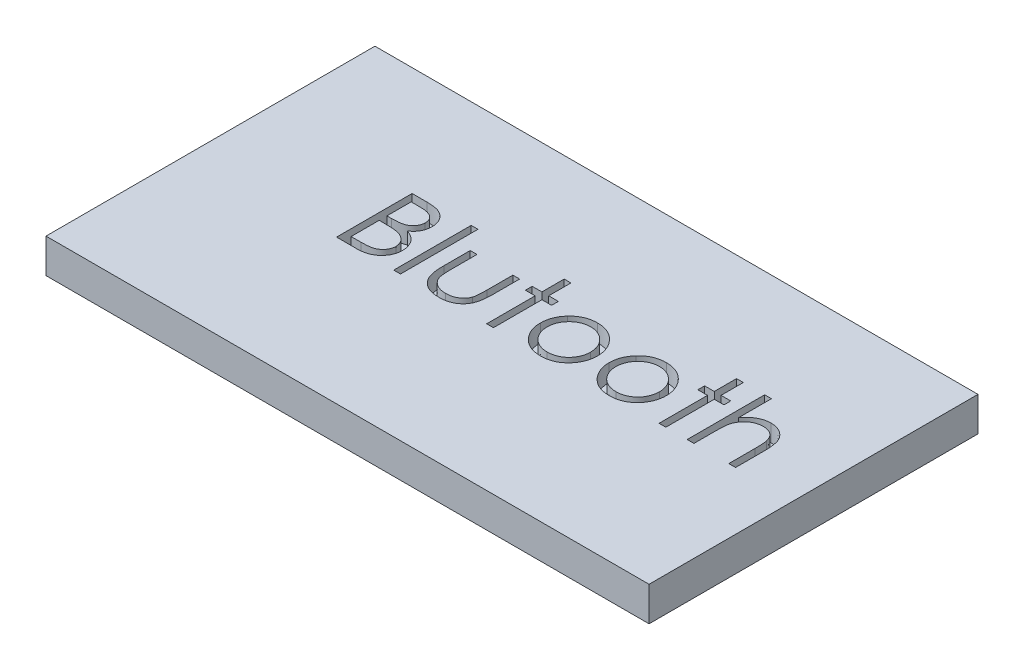
from build123d import *

# Parameters (mm, degrees)
SKETCH1_W           = 27.94
SKETCH1_H           = 15.24
BOSS_EXTRUDE1_DEPTH = 1.5875
SKETCH2_W           = 0.314102564
SKETCH2_H           = 3.58974359
CUT_EXTRUDE1_DEPTH  = 0.79375


with BuildPart() as part:
    # Sketch1 → Boss-Extrude1 (new body)
    with BuildSketch(Plane(origin=(0, 0, 0), x_dir=(1, 0, 0), z_dir=(0, 1, 0))):
        Rectangle(SKETCH1_W, SKETCH1_H)
    extrude(amount=BOSS_EXTRUDE1_DEPTH)

    # Sketch2 → Cut-Extrude1 (cut)
    # profile 1 of 8: a face of its own
    with BuildSketch(Plane(origin=(0, 1.5875, 0), x_dir=(1, 0, 0), z_dir=(0, 1, 0))):
        with BuildLine():
            Line((-7.198179967, 2.570414857), (-6.515287339, 2.570414857))
            add(Edge.make_bspline(
                [(-6.515287339, 2.570414857), (-6.481858861, 2.570239107), (-6.417066151, 2.569898459), (-6.322846709, 2.564615328), (-6.234597898, 2.557411658), (-6.152294126, 2.545981565), (-6.075973423, 2.532189788), (-6.005405786, 2.515487972), (-5.940815614, 2.495461358), (-5.863702877, 2.463615077), (-5.775782217, 2.416291909), (-5.680583824, 2.346363344), (-5.599179585, 2.26083088), (-5.528993267, 2.164348225), (-5.473192148, 2.058212453), (-5.43282285, 1.944953264), (-5.407264975, 1.826031523), (-5.404636541, 1.744388345), (-5.403308172, 1.703127197)],
                knots=[0, 0, 0, 0, 1.001505555, 1.941167018, 2.826882275, 3.653841531, 4.429895133, 5.150066043, 5.825578002, 6.45369114, 7.647487171, 8.808567382, 9.977351308, 11.170798116, 12.373658725, 13.556498008, 14.765093433, 16, 16, 16, 16], degree=3))
            add(Edge.make_bspline(
                [(-5.403308172, 1.703127197), (-5.404401391, 1.664474641), (-5.406549668, 1.588518724), (-5.427092428, 1.477424615), (-5.459253096, 1.371673396), (-5.503958345, 1.271651011), (-5.562060341, 1.179617398), (-5.63091866, 1.094830132), (-5.713995463, 1.020879075), (-5.776238703, 0.979536172), (-5.807855448, 0.958535851)],
                knots=[0, 0, 0, 0, 1.044552857, 2.05264487, 3.044412934, 4.028983338, 5.005914585, 5.980388656, 6.974128949, 8, 8, 8, 8], degree=3))
            add(Edge.make_bspline(
                [(-5.807855448, 0.958535851), (-5.768095021, 0.943270852), (-5.692023473, 0.914065128), (-5.587337461, 0.862429664), (-5.497142616, 0.806267553), (-5.42074547, 0.744935703), (-5.355407815, 0.678826892), (-5.298354873, 0.606971778), (-5.249673499, 0.52843302), (-5.207960576, 0.444029485), (-5.175411819, 0.354623016), (-5.151035915, 0.26105224), (-5.137068466, 0.163652685), (-5.135080825, 0.097367306), (-5.134077403, 0.063904441)],
                knots=[0, 0, 0, 0, 1.27268992, 2.434971085, 3.483601985, 4.442670788, 5.356604649, 6.2567628, 7.179492994, 8.113709626, 9.066344395, 10.018646069, 10.999752585, 12, 12, 12, 12], degree=3))
            add(Edge.make_bspline(
                [(-5.134077403, 0.063904441), (-5.135054249, 0.029737568), (-5.136976221, -0.03748671), (-5.151156193, -0.136241844), (-5.1751653, -0.230616791), (-5.208236446, -0.321221974), (-5.251398761, -0.407882108), (-5.303926725, -0.490695372), (-5.366558289, -0.568829703), (-5.436621158, -0.643153326), (-5.515883303, -0.709981113), (-5.601399058, -0.76949682), (-5.694245378, -0.818442882), (-5.792897372, -0.859558903), (-5.898461688, -0.890966102), (-6.010464296, -0.912938676), (-6.128808597, -0.927743713), (-6.210018349, -0.928960918), (-6.251665544, -0.929585143)],
                knots=[0, 0, 0, 0, 0.978564426, 1.925352924, 2.850884081, 3.763762016, 4.682927383, 5.618979971, 6.567305752, 7.547517671, 8.540179244, 9.531824382, 10.526200242, 11.540722885, 12.589160233, 13.674978461, 14.80764778, 16, 16, 16, 16], degree=3))
            Line((-6.251665544, -0.929585143), (-7.198179967, -0.929585143))
            Line((-7.198179967, -0.929585143), (-7.198179967, 2.570414857))
        make_face()
        with BuildLine():
            Line((-6.884077403, 2.211440498), (-6.884077403, 1.089645626))
            Line((-6.884077403, 1.089645626), (-6.673039743, 1.089645626))
            add(Edge.make_bspline(
                [(-6.673039743, 1.089645626), (-6.642190948, 1.090045549), (-6.582584788, 1.090818282), (-6.496264892, 1.093031799), (-6.416139874, 1.099229843), (-6.342348041, 1.105426105), (-6.275005597, 1.115500692), (-6.214261735, 1.127492815), (-6.159163138, 1.14017572), (-6.095623593, 1.161745207), (-6.023550644, 1.193622883), (-5.94671754, 1.243094719), (-5.87898307, 1.302019072), (-5.821785883, 1.370010034), (-5.774974412, 1.444876219), (-5.742460697, 1.5254231), (-5.720413413, 1.609643232), (-5.718421881, 1.667461485), (-5.717410737, 1.696817101)],
                knots=[0, 0, 0, 0, 1.156816544, 2.235205308, 3.236616184, 4.169592532, 5.011045266, 5.787822928, 6.49130361, 7.128639758, 8.301311294, 9.436451833, 10.541879658, 11.654887649, 12.756523258, 13.837046038, 14.901820046, 16, 16, 16, 16], degree=3))
            add(Edge.make_bspline(
                [(-5.717410737, 1.696817101), (-5.717936917, 1.716242872), (-5.718969077, 1.754348644), (-5.727422379, 1.809897999), (-5.741789954, 1.862141751), (-5.760244247, 1.911795861), (-5.786032936, 1.957307712), (-5.816396399, 2.000250907), (-5.853082089, 2.039163026), (-5.894839402, 2.075532524), (-5.942848025, 2.107777052), (-5.997079317, 2.136017815), (-6.058266994, 2.158758592), (-6.125379849, 2.178674744), (-6.199450936, 2.192663038), (-6.27962549, 2.204316426), (-6.366560209, 2.210249168), (-6.426705311, 2.211034531), (-6.457795352, 2.211440498)],
                knots=[0, 0, 0, 0, 0.91205012, 1.789085906, 2.630437955, 3.453916878, 4.269457761, 5.079663411, 5.91843418, 6.774407191, 7.675494373, 8.627863946, 9.638891023, 10.736472738, 11.911756761, 13.175263542, 14.539845004, 16, 16, 16, 16], degree=3))
            Line((-6.457795352, 2.211440498), (-6.884077403, 2.211440498))
        make_face(mode=Mode.SUBTRACT)
        with BuildLine():
            Line((-6.884077403, 0.730671268), (-6.884077403, -0.570610784))
            Line((-6.884077403, -0.570610784), (-6.436761698, -0.570610784))
            add(Edge.make_bspline(
                [(-6.436761698, -0.570610784), (-6.404742772, -0.570227036), (-6.343030514, -0.569487414), (-6.253929284, -0.567072859), (-6.17134618, -0.561580584), (-6.095658044, -0.552934734), (-6.026047591, -0.543556285), (-5.963349888, -0.530945004), (-5.907056695, -0.516496043), (-5.841782387, -0.494161871), (-5.768278879, -0.4594654), (-5.689068022, -0.407151174), (-5.618641804, -0.344827866), (-5.558836545, -0.272696952), (-5.509823557, -0.194265625), (-5.474168101, -0.111120275), (-5.452177245, -0.024634747), (-5.449515075, 0.034331965), (-5.448179967, 0.063904441)],
                knots=[0, 0, 0, 0, 1.160039823, 2.235823828, 3.228722157, 4.157150951, 4.99529583, 5.772374946, 6.472645482, 7.099169577, 8.269452708, 9.405989375, 10.527446681, 11.663510218, 12.788923519, 13.866172445, 14.929861265, 16, 16, 16, 16], degree=3))
            add(Edge.make_bspline(
                [(-5.448179967, 0.063904441), (-5.448456072, 0.082397781), (-5.449003827, 0.119086163), (-5.457264442, 0.173001982), (-5.469278311, 0.225227855), (-5.484809745, 0.275905596), (-5.507429212, 0.324118972), (-5.533835757, 0.370821532), (-5.564797159, 0.416075011), (-5.613041325, 0.473287265), (-5.68321331, 0.539204278), (-5.782920085, 0.60374178), (-5.896292383, 0.655789587), (-5.978519876, 0.677889063), (-6.020996474, 0.689305082)],
                knots=[0, 0, 0, 0, 0.723448775, 1.435228256, 2.130040452, 2.821711965, 3.505591119, 4.210454504, 4.921174351, 5.648778258, 7.137944449, 8.670945889, 10.280296675, 12, 12, 12, 12], degree=3))
            add(Edge.make_bspline(
                [(-6.020996474, 0.689305082), (-6.03802557, 0.692760166), (-6.074948162, 0.7002515), (-6.135155742, 0.708159204), (-6.203891611, 0.715204264), (-6.281314489, 0.720415421), (-6.36752233, 0.725801965), (-6.462699248, 0.727896786), (-6.566456563, 0.730396046), (-6.638448935, 0.73057718), (-6.67584423, 0.730671268)],
                knots=[0, 0, 0, 0, 0.634451884, 1.375622551, 2.216452059, 3.157844607, 4.20941857, 5.370758133, 6.634282058, 8, 8, 8, 8], degree=3))
            Line((-6.67584423, 0.730671268), (-6.884077403, 0.730671268))
        make_face(mode=Mode.SUBTRACT)
    # profile 2 of 8: a face of its own
    with BuildSketch(Plane(origin=(0, 1.5875, 0), x_dir=(1, 0, 0), z_dir=(0, 1, 0))):
        with Locations((-4.393692788, 0.865286652)):
            Rectangle(SKETCH2_W, SKETCH2_H)
    # profile 3 of 8: a face of its own
    with BuildSketch(Plane(origin=(0, 1.5875, 0), x_dir=(1, 0, 0), z_dir=(0, 1, 0))):
        with BuildLine():
            Line((-3.563564583, 1.628107165), (-3.249462019, 1.628107165))
            Line((-3.249462019, 1.628107165), (-3.249462019, 0.441809088))
            add(Edge.make_bspline(
                [(-3.249462019, 0.441809088), (-3.249320114, 0.406986339), (-3.249048656, 0.340372051), (-3.247207715, 0.244516864), (-3.242877622, 0.157100151), (-3.237463797, 0.078071415), (-3.230501661, 0.007444023), (-3.222218301, -0.054535334), (-3.212959879, -0.108569518), (-3.203897165, -0.141112874), (-3.199682371, -0.156247803)],
                knots=[0, 0, 0, 0, 1.388932606, 2.656963016, 3.823490214, 4.879454478, 5.816252168, 6.653371382, 7.373723809, 8, 8, 8, 8], degree=3))
            add(Edge.make_bspline(
                [(-3.199682371, -0.156247803), (-3.192920916, -0.175270674), (-3.179538575, -0.212920935), (-3.155265091, -0.26730994), (-3.125236755, -0.317685223), (-3.092376927, -0.365989295), (-3.054477519, -0.410791282), (-3.012018048, -0.452015526), (-2.966419811, -0.491219617), (-2.898664788, -0.537604409), (-2.806005522, -0.587319739), (-2.684352767, -0.630215558), (-2.552448541, -0.655851378), (-2.461283821, -0.658825633), (-2.414425961, -0.660354374)],
                knots=[0, 0, 0, 0, 0.725840625, 1.436591201, 2.137033971, 2.831655856, 3.53531722, 4.242432219, 4.957935707, 5.694543706, 7.190802206, 8.724350549, 10.316345118, 12, 12, 12, 12], degree=3))
            add(Edge.make_bspline(
                [(-2.414425961, -0.660354374), (-2.367572453, -0.658793125), (-2.276919585, -0.655772398), (-2.146464616, -0.630988859), (-2.027213201, -0.58958317), (-1.92036225, -0.531775758), (-1.82639641, -0.461033696), (-1.748091991, -0.378024887), (-1.683484736, -0.2853755), (-1.655275316, -0.216251221), (-1.641088621, -0.181488188)],
                knots=[0, 0, 0, 0, 1.157059328, 2.238695713, 3.266970494, 4.264342957, 5.228770407, 6.160125903, 7.074715775, 8, 8, 8, 8], degree=3))
            add(Edge.make_bspline(
                [(-1.641088621, -0.181488188), (-1.636894391, -0.167521889), (-1.627621973, -0.136645814), (-1.617659621, -0.084266065), (-1.60868516, -0.021801461), (-1.601021984, 0.051156748), (-1.595556821, 0.134417901), (-1.592610794, 0.227955977), (-1.589282519, 0.331477337), (-1.589232003, 0.403945096), (-1.589205608, 0.441809088)],
                knots=[0, 0, 0, 0, 0.557542046, 1.232589297, 2.036731608, 2.971723315, 4.038036528, 5.22795436, 6.551621927, 8, 8, 8, 8], degree=3))
            Line((-1.589205608, 0.441809088), (-1.589205608, 1.628107165))
            Line((-1.589205608, 1.628107165), (-1.275103044, 1.628107165))
            Line((-1.275103044, 1.628107165), (-1.275103044, 0.382914857))
            add(Edge.make_bspline(
                [(-1.275103044, 0.382914857), (-1.275544739, 0.340607686), (-1.276401687, 0.258525986), (-1.281909031, 0.139241874), (-1.291358644, 0.02807963), (-1.305701329, -0.07501959), (-1.322567003, -0.169977072), (-1.344323276, -0.256914518), (-1.370301514, -0.335564072), (-1.399607029, -0.407305849), (-1.434228896, -0.472352743), (-1.471055917, -0.53408856), (-1.513580689, -0.590981495), (-1.558350923, -0.645863632), (-1.608152579, -0.696005159), (-1.662052438, -0.742556635), (-1.719291858, -0.786229667), (-1.781141056, -0.825320946), (-1.846697119, -0.860537592), (-1.916040976, -0.89175367), (-1.990021974, -0.916456247), (-2.067685611, -0.937766913), (-2.14941239, -0.954481382), (-2.235123523, -0.966267949), (-2.324790139, -0.97349328), (-2.385899599, -0.974130324), (-2.417230448, -0.974456938)],
                knots=[0, 0, 0, 0, 1.493040784, 2.896703357, 4.213163133, 5.428574705, 6.569057535, 7.615249723, 8.588095153, 9.490268104, 10.346124644, 11.18633936, 12.024365274, 12.850166724, 13.684164916, 14.514361689, 15.362232829, 16.222528818, 17.093394965, 17.986930858, 18.902426812, 19.842810585, 20.827885679, 21.843828298, 22.894529745, 24, 24, 24, 24], degree=3))
            add(Edge.make_bspline(
                [(-2.417230448, -0.974456938), (-2.448326962, -0.97411723), (-2.509434507, -0.973449674), (-2.599105752, -0.966307867), (-2.685054358, -0.954499696), (-2.766974756, -0.937644479), (-2.844949154, -0.916605409), (-2.919293394, -0.891601873), (-2.989136957, -0.860521391), (-3.055318961, -0.825543834), (-3.117321349, -0.785978559), (-3.175429927, -0.742610519), (-3.229566779, -0.695504456), (-3.279743847, -0.644857099), (-3.325256824, -0.590040162), (-3.366672866, -0.531494602), (-3.404629571, -0.469800513), (-3.438982361, -0.403737351), (-3.468494117, -0.331165341), (-3.494549363, -0.250868244), (-3.515860001, -0.161965727), (-3.533202469, -0.064533799), (-3.54715391, 0.040961243), (-3.556840052, 0.155129658), (-3.562255883, 0.27769335), (-3.563118944, 0.36234324), (-3.563564583, 0.406051876)],
                knots=[0, 0, 0, 0, 1.083640291, 2.129454052, 3.13281866, 4.105697902, 5.042300162, 5.946461698, 6.836384745, 7.703652036, 8.553297018, 9.397182691, 10.228592656, 11.052265423, 11.879314572, 12.708807002, 13.549817954, 14.402308542, 15.300838682, 16.27712199, 17.341985831, 18.484375296, 19.725102775, 21.0496083, 22.476576903, 24, 24, 24, 24], degree=3))
            Line((-3.563564583, 0.406051876), (-3.563564583, 1.628107165))
        make_face()
    # profile 4 of 8: a face of its own
    with BuildSketch(Plane(origin=(0, 1.5875, 0), x_dir=(1, 0, 0), z_dir=(0, 1, 0))):
        Polygon((-0.243051762, 2.660158447), (0.071050802, 2.660158447), (0.071050802, 1.628107165), (0.519768751, 1.628107165), (0.519768751, 1.314004601), (0.071050802, 1.314004601), (0.071050802, -0.929585143), (-0.243051762, -0.929585143), (-0.243051762, 1.314004601), (-0.691769711, 1.314004601), (-0.691769711, 1.628107165), (-0.243051762, 1.628107165), align=None)
    # profile 5 of 8: a face of its own
    with BuildSketch(Plane(origin=(0, 1.5875, 0), x_dir=(1, 0, 0), z_dir=(0, 1, 0))):
        with BuildLine():
            add(Edge.make_bspline(
                [(2.293606892, 1.67297896), (2.341598164, 1.671957069), (2.435697322, 1.66995339), (2.573505208, 1.648538424), (2.705050344, 1.61579106), (2.830836536, 1.570519498), (2.949252831, 1.509837547), (3.062024076, 1.437428256), (3.168841084, 1.351645663), (3.232864114, 1.285287594), (3.265361699, 1.251604761)],
                knots=[0, 0, 0, 0, 1.054011418, 2.066658804, 3.057071809, 4.030435133, 4.997543892, 5.974964718, 6.972108034, 8, 8, 8, 8], degree=3))
            add(Edge.make_bspline(
                [(3.265361699, 1.251604761), (3.293343653, 1.219390775), (3.348766034, 1.155586233), (3.419831752, 1.05213062), (3.481053313, 0.94499052), (3.530116274, 0.832743193), (3.568801297, 0.716368522), (3.596266993, 0.595466511), (3.612603928, 0.470304163), (3.614806895, 0.385300325), (3.615922597, 0.342249793)],
                knots=[0, 0, 0, 0, 1.025258237, 2.030674902, 3.01204498, 3.988269485, 4.97094183, 5.956517959, 6.965070386, 8, 8, 8, 8], degree=3))
            add(Edge.make_bspline(
                [(3.615922597, 0.342249793), (3.614941259, 0.298949735), (3.613002091, 0.213386802), (3.594658475, 0.087367436), (3.566127389, -0.034827386), (3.525295551, -0.15268608), (3.472937441, -0.266568907), (3.409046754, -0.375978457), (3.333175137, -0.48113059), (3.24717114, -0.581132428), (3.152119264, -0.673298643), (3.049003116, -0.753626913), (2.939849082, -0.822448437), (2.823205728, -0.877884853), (2.700138242, -0.921594553), (2.570381174, -0.952294569), (2.434136103, -0.970856253), (2.341108882, -0.973239826), (2.293606892, -0.974456938)],
                knots=[0, 0, 0, 0, 0.998656419, 1.973391657, 2.932242238, 3.890759089, 4.846373663, 5.82037756, 6.809684879, 7.83454468, 8.860553229, 9.859544525, 10.845671541, 11.83227036, 12.833544569, 13.85385346, 14.904124723, 16, 16, 16, 16], degree=3))
            add(Edge.make_bspline(
                [(2.293606892, -0.974456938), (2.245872172, -0.973235741), (2.152381312, -0.970843967), (2.01565533, -0.952366684), (1.885665712, -0.921608702), (1.762437113, -0.877741209), (1.645292266, -0.822446665), (1.535505769, -0.753834976), (1.432305854, -0.67327482), (1.337233869, -0.581138883), (1.251235264, -0.481128927), (1.175362255, -0.375978888), (1.111471929, -0.266568795), (1.059113725, -0.15268611), (1.018281913, -0.034827378), (0.98975082, 0.087367434), (0.971407205, 0.213386803), (0.969468037, 0.298949736), (0.968486699, 0.342249793)],
                knots=[0, 0, 0, 0, 1.099876186, 2.154163076, 3.173186993, 4.173200201, 5.163417411, 6.152872554, 7.150605724, 8.17532212, 9.198891216, 10.186952605, 11.159729845, 12.11414092, 13.071450619, 14.029093627, 15.002601286, 16, 16, 16, 16], degree=3))
            add(Edge.make_bspline(
                [(0.968486699, 0.342249793), (0.96961001, 0.385066339), (0.971833971, 0.469835741), (0.98815448, 0.594762802), (1.015513037, 0.715460191), (1.054244433, 0.831385667), (1.103759624, 0.943141103), (1.164120912, 1.050545934), (1.235911545, 1.153533735), (1.291113496, 1.217255815), (1.319047597, 1.249501396)],
                knots=[0, 0, 0, 0, 1.031353054, 2.041901799, 3.029428768, 4.008703097, 4.981709435, 5.96992636, 6.972712378, 8, 8, 8, 8], degree=3))
            add(Edge.make_bspline(
                [(1.319047597, 1.249501396), (1.351496188, 1.283476335), (1.415312052, 1.350294031), (1.522660779, 1.435826555), (1.6351546, 1.509742629), (1.754879527, 1.569218845), (1.880562385, 1.616057362), (2.012781627, 1.648622877), (2.151057143, 1.669876232), (2.245616764, 1.67193441), (2.293606892, 1.67297896)],
                knots=[0, 0, 0, 0, 1.027980169, 2.021703884, 2.998553061, 3.971491411, 4.943284454, 5.930300938, 6.949603206, 8, 8, 8, 8], degree=3))
        make_face()
        with BuildLine():
            add(Edge.make_bspline(
                [(2.292204648, 1.358876396), (2.258267037, 1.357911804), (2.191267908, 1.356007521), (2.092648323, 1.341523617), (1.997708169, 1.318576113), (1.906267325, 1.285972056), (1.818634153, 1.243873158), (1.73472475, 1.192164797), (1.654292311, 1.131531841), (1.578910247, 1.062069169), (1.509727935, 0.986190175), (1.449249958, 0.905341816), (1.397824852, 0.82083547), (1.354984693, 0.732583258), (1.323077505, 0.639690844), (1.299904483, 0.543210213), (1.285434242, 0.442944797), (1.283547863, 0.374783778), (1.282589263, 0.340146428)],
                knots=[0, 0, 0, 0, 1.021534396, 2.016698045, 2.994645724, 3.958388632, 4.93408049, 5.916473867, 6.921342795, 7.962252576, 8.998418191, 10.008913653, 10.997312074, 11.973003931, 12.956656626, 13.948281152, 14.957379055, 16, 16, 16, 16], degree=3))
            add(Edge.make_bspline(
                [(1.282589263, 0.340146428), (1.284196087, 0.295394401), (1.287385332, 0.206569995), (1.313320568, 0.075758872), (1.356706848, -0.04982298), (1.415294128, -0.169439366), (1.488700346, -0.280111644), (1.575187413, -0.378783128), (1.673827113, -0.46396894), (1.783443613, -0.534649785), (1.901797931, -0.590809541), (2.027054252, -0.630608517), (2.157694947, -0.656480209), (2.246975678, -0.659051683), (2.292204648, -0.660354374)],
                knots=[0, 0, 0, 0, 1.016792936, 2.018143844, 3.017858371, 4.030088057, 5.03801393, 6.028138512, 7.003788237, 7.991172063, 8.984598303, 9.972568034, 10.972917682, 12, 12, 12, 12], degree=3))
            add(Edge.make_bspline(
                [(2.292204648, -0.660354374), (2.337431017, -0.659044093), (2.426706613, -0.656457636), (2.55716579, -0.630738817), (2.682079762, -0.590635156), (2.800311149, -0.534712946), (2.909877753, -0.463700531), (3.009226874, -0.379264154), (3.094975485, -0.279850303), (3.16830909, -0.169292774), (3.227855833, -0.050008422), (3.271039034, 0.07578205), (3.29703662, 0.206564092), (3.300217449, 0.295392423), (3.301820033, 0.340146428)],
                knots=[0, 0, 0, 0, 1.02726834, 2.027799167, 3.010890988, 4.004497153, 4.992059811, 5.971914811, 6.958719428, 7.966827853, 8.981595046, 9.981490638, 10.983022906, 12, 12, 12, 12], degree=3))
            add(Edge.make_bspline(
                [(3.301820033, 0.340146428), (3.300861763, 0.374783985), (3.298976034, 0.442945411), (3.284501069, 0.543207865), (3.261345529, 0.639699461), (3.229373912, 0.732551465), (3.186719898, 0.821063969), (3.134303105, 0.905093696), (3.07407208, 0.986470242), (3.004054959, 1.061823883), (2.928751581, 1.131558919), (2.848286543, 1.192188309), (2.764501564, 1.243645904), (2.677122982, 1.286332145), (2.585670414, 1.318279485), (2.490863285, 1.341656117), (2.392664475, 1.355946313), (2.325905432, 1.357893455), (2.292204648, 1.358876396)],
                knots=[0, 0, 0, 0, 1.042956736, 2.052379634, 3.044323526, 4.02829302, 5.004299113, 5.996692471, 7.007513377, 8.048758398, 9.090003419, 10.095195979, 11.07790575, 12.047570684, 13.018257071, 13.989683339, 14.985167495, 16, 16, 16, 16], degree=3))
        make_face(mode=Mode.SUBTRACT)
    # profile 6 of 8: a face of its own
    with BuildSketch(Plane(origin=(0, 1.5875, 0), x_dir=(1, 0, 0), z_dir=(0, 1, 0))):
        with BuildLine():
            add(Edge.make_bspline(
                [(5.479504328, 1.67297896), (5.5274956, 1.671957069), (5.621594758, 1.66995339), (5.759402644, 1.648538424), (5.89094778, 1.61579106), (6.016733972, 1.570519498), (6.135150267, 1.509837547), (6.247921511, 1.437428256), (6.35473852, 1.351645663), (6.41876155, 1.285287594), (6.451259135, 1.251604761)],
                knots=[0, 0, 0, 0, 1.054011418, 2.066658804, 3.057071809, 4.030435133, 4.997543892, 5.974964718, 6.972108034, 8, 8, 8, 8], degree=3))
            add(Edge.make_bspline(
                [(6.451259135, 1.251604761), (6.479241089, 1.219390775), (6.53466347, 1.155586233), (6.605729188, 1.05213062), (6.666950748, 0.94499052), (6.716013709, 0.832743193), (6.754698733, 0.716368522), (6.782164429, 0.595466511), (6.798501364, 0.470304163), (6.800704331, 0.385300325), (6.801820033, 0.342249793)],
                knots=[0, 0, 0, 0, 1.025258237, 2.030674902, 3.01204498, 3.988269485, 4.97094183, 5.956517959, 6.965070386, 8, 8, 8, 8], degree=3))
            add(Edge.make_bspline(
                [(6.801820033, 0.342249793), (6.800838695, 0.298949735), (6.798899527, 0.213386802), (6.780555911, 0.087367436), (6.752024825, -0.034827386), (6.711192987, -0.15268608), (6.658834877, -0.266568907), (6.59494419, -0.375978457), (6.519072573, -0.48113059), (6.433068576, -0.581132428), (6.3380167, -0.673298643), (6.234900551, -0.753626913), (6.125746518, -0.822448437), (6.009103164, -0.877884853), (5.886035678, -0.921594553), (5.756278609, -0.952294569), (5.620033539, -0.970856253), (5.527006318, -0.973239826), (5.479504328, -0.974456938)],
                knots=[0, 0, 0, 0, 0.998656419, 1.973391657, 2.932242238, 3.890759089, 4.846373663, 5.82037756, 6.809684879, 7.83454468, 8.860553229, 9.859544525, 10.845671541, 11.83227036, 12.833544569, 13.85385346, 14.904124723, 16, 16, 16, 16], degree=3))
            add(Edge.make_bspline(
                [(5.479504328, -0.974456938), (5.431769608, -0.973235741), (5.338278748, -0.970843967), (5.201552766, -0.952366684), (5.071563147, -0.921608702), (4.948334549, -0.877741209), (4.831189702, -0.822446665), (4.721403205, -0.753834976), (4.618203289, -0.67327482), (4.523131305, -0.581138883), (4.4371327, -0.481128927), (4.361259691, -0.375978888), (4.297369365, -0.266568795), (4.245011161, -0.15268611), (4.204179348, -0.034827378), (4.175648256, 0.087367434), (4.157304641, 0.213386803), (4.155365473, 0.298949736), (4.154384135, 0.342249793)],
                knots=[0, 0, 0, 0, 1.099876186, 2.154163076, 3.173186993, 4.173200201, 5.163417411, 6.152872554, 7.150605724, 8.17532212, 9.198891216, 10.186952605, 11.159729845, 12.11414092, 13.071450619, 14.029093627, 15.002601286, 16, 16, 16, 16], degree=3))
            add(Edge.make_bspline(
                [(4.154384135, 0.342249793), (4.155507446, 0.385066339), (4.157731407, 0.469835741), (4.174051916, 0.594762802), (4.201410473, 0.715460191), (4.240141869, 0.831385667), (4.28965706, 0.943141103), (4.350018348, 1.050545934), (4.42180898, 1.153533735), (4.477010932, 1.217255815), (4.504945033, 1.249501396)],
                knots=[0, 0, 0, 0, 1.031353054, 2.041901799, 3.029428768, 4.008703097, 4.981709435, 5.96992636, 6.972712378, 8, 8, 8, 8], degree=3))
            add(Edge.make_bspline(
                [(4.504945033, 1.249501396), (4.537393624, 1.283476335), (4.601209488, 1.350294031), (4.708558215, 1.435826555), (4.821052036, 1.509742629), (4.940776962, 1.569218845), (5.06645982, 1.616057362), (5.198679063, 1.648622877), (5.336954578, 1.669876232), (5.4315142, 1.67193441), (5.479504328, 1.67297896)],
                knots=[0, 0, 0, 0, 1.027980169, 2.021703884, 2.998553061, 3.971491411, 4.943284454, 5.930300938, 6.949603206, 8, 8, 8, 8], degree=3))
        make_face()
        with BuildLine():
            add(Edge.make_bspline(
                [(5.478102084, 1.358876396), (5.444164473, 1.357911804), (5.377165344, 1.356007521), (5.278545759, 1.341523617), (5.183605605, 1.318576113), (5.092164761, 1.285972056), (5.004531589, 1.243873158), (4.920622186, 1.192164797), (4.840189746, 1.131531841), (4.764807683, 1.062069169), (4.695625371, 0.986190175), (4.635147394, 0.905341816), (4.583722288, 0.82083547), (4.540882129, 0.732583258), (4.508974941, 0.639690844), (4.485801918, 0.543210213), (4.471331678, 0.442944797), (4.469445299, 0.374783778), (4.468486699, 0.340146428)],
                knots=[0, 0, 0, 0, 1.021534396, 2.016698045, 2.994645724, 3.958388632, 4.93408049, 5.916473867, 6.921342795, 7.962252576, 8.998418191, 10.008913653, 10.997312074, 11.973003931, 12.956656626, 13.948281152, 14.957379055, 16, 16, 16, 16], degree=3))
            add(Edge.make_bspline(
                [(4.468486699, 0.340146428), (4.470093523, 0.295394401), (4.473282767, 0.206569995), (4.499218004, 0.075758872), (4.542604284, -0.04982298), (4.601191563, -0.169439366), (4.674597782, -0.280111644), (4.761084849, -0.378783128), (4.859724549, -0.46396894), (4.969341049, -0.534649785), (5.087695367, -0.590809541), (5.212951688, -0.630608517), (5.343592382, -0.656480209), (5.432873114, -0.659051683), (5.478102084, -0.660354374)],
                knots=[0, 0, 0, 0, 1.016792936, 2.018143844, 3.017858371, 4.030088057, 5.03801393, 6.028138512, 7.003788237, 7.991172063, 8.984598303, 9.972568034, 10.972917682, 12, 12, 12, 12], degree=3))
            add(Edge.make_bspline(
                [(5.478102084, -0.660354374), (5.523328453, -0.659044093), (5.612604049, -0.656457636), (5.743063226, -0.630738817), (5.867977198, -0.590635156), (5.986208585, -0.534712946), (6.095775188, -0.463700531), (6.19512431, -0.379264154), (6.280872921, -0.279850303), (6.354206526, -0.169292774), (6.413753269, -0.050008422), (6.45693647, 0.07578205), (6.482934056, 0.206564092), (6.486114885, 0.295392423), (6.487717469, 0.340146428)],
                knots=[0, 0, 0, 0, 1.02726834, 2.027799167, 3.010890988, 4.004497153, 4.992059811, 5.971914811, 6.958719428, 7.966827853, 8.981595046, 9.981490638, 10.983022906, 12, 12, 12, 12], degree=3))
            add(Edge.make_bspline(
                [(6.487717469, 0.340146428), (6.486759199, 0.374783985), (6.484873469, 0.442945411), (6.470398505, 0.543207865), (6.447242965, 0.639699461), (6.415271348, 0.732551465), (6.372617334, 0.821063969), (6.320200541, 0.905093696), (6.259969516, 0.986470242), (6.189952395, 1.061823883), (6.114649017, 1.131558919), (6.034183979, 1.192188309), (5.950399, 1.243645904), (5.863020418, 1.286332145), (5.77156785, 1.318279485), (5.676760721, 1.341656117), (5.578561911, 1.355946313), (5.511802868, 1.357893455), (5.478102084, 1.358876396)],
                knots=[0, 0, 0, 0, 1.042956736, 2.052379634, 3.044323526, 4.02829302, 5.004299113, 5.996692471, 7.007513377, 8.048758398, 9.090003419, 10.095195979, 11.07790575, 12.047570684, 13.018257071, 13.989683339, 14.985167495, 16, 16, 16, 16], degree=3))
        make_face(mode=Mode.SUBTRACT)
    # profile 7 of 8: a face of its own
    with BuildSketch(Plane(origin=(0, 1.5875, 0), x_dir=(1, 0, 0), z_dir=(0, 1, 0))):
        Polygon((7.744127725, 2.660158447), (8.058230289, 2.660158447), (8.058230289, 1.628107165), (8.506948238, 1.628107165), (8.506948238, 1.314004601), (8.058230289, 1.314004601), (8.058230289, -0.929585143), (7.744127725, -0.929585143), (7.744127725, 1.314004601), (7.295409776, 1.314004601), (7.295409776, 1.628107165), (7.744127725, 1.628107165), align=None)
    # profile 8 of 8: a face of its own
    with BuildSketch(Plane(origin=(0, 1.5875, 0), x_dir=(1, 0, 0), z_dir=(0, 1, 0))):
        with BuildLine():
            Line((9.045409776, 2.660158447), (9.35951234, 2.660158447))
            Line((9.35951234, 2.660158447), (9.35951234, 1.145034248))
            add(Edge.make_bspline(
                [(9.35951234, 1.145034248), (9.393229642, 1.18717823), (9.458878956, 1.269234723), (9.569375073, 1.376295914), (9.682845945, 1.469094535), (9.803210755, 1.542964992), (9.928261275, 1.601321536), (10.058524919, 1.642709182), (10.194025891, 1.668160279), (10.286051041, 1.671358697), (10.332669392, 1.67297896)],
                knots=[0, 0, 0, 0, 1.125788106, 2.19196713, 3.20547328, 4.180437432, 5.132270164, 6.079753143, 7.027236121, 8, 8, 8, 8], degree=3))
            add(Edge.make_bspline(
                [(10.332669392, 1.67297896), (10.379999784, 1.67123353), (10.47263678, 1.667817301), (10.607518243, 1.64080392), (10.733479118, 1.594646482), (10.85014496, 1.531479457), (10.954969657, 1.45280663), (11.047819422, 1.361975107), (11.12366022, 1.256701189), (11.175259337, 1.159444935), (11.208832745, 1.072906181), (11.230084572, 0.998669669), (11.24810377, 0.915947756), (11.263803506, 0.824783024), (11.274267087, 0.724737852), (11.282671705, 0.616263598), (11.28864816, 0.49936648), (11.288879764, 0.41844623), (11.28899952, 0.376604761)],
                knots=[0, 0, 0, 0, 1.235656852, 2.418478516, 3.575258207, 4.727955599, 5.870717718, 6.98870536, 8.107142894, 9.245821548, 9.854588956, 10.528768408, 11.260415777, 12.065282286, 12.943670737, 13.886611085, 14.907229059, 16, 16, 16, 16], degree=3))
            Line((11.28899952, 0.376604761), (11.28899952, -0.929585143))
            Line((11.28899952, -0.929585143), (10.974896956, -0.929585143))
            Line((10.974896956, -0.929585143), (10.974896956, 0.273539857))
            add(Edge.make_bspline(
                [(10.974896956, 0.273539857), (10.974706653, 0.308362527), (10.974342635, 0.374972367), (10.97313929, 0.470338476), (10.970453075, 0.55683461), (10.966112249, 0.634183562), (10.961546942, 0.702493165), (10.955263625, 0.76166422), (10.947953391, 0.811777995), (10.941384609, 0.841942624), (10.938438622, 0.855470947)],
                knots=[0, 0, 0, 0, 1.430932559, 2.737130458, 3.918967929, 4.986496826, 5.920444988, 6.731744033, 7.431208747, 8, 8, 8, 8], degree=3))
            add(Edge.make_bspline(
                [(10.938438622, 0.855470947), (10.927014377, 0.895165211), (10.905051333, 0.971477201), (10.854003355, 1.075139611), (10.790244344, 1.163524352), (10.712397083, 1.23543864), (10.621838719, 1.29185018), (10.517978755, 1.330917962), (10.401794686, 1.355165684), (10.319943214, 1.357604987), (10.27728077, 1.358876396)],
                knots=[0, 0, 0, 0, 1.090059168, 2.095632401, 3.037101401, 3.955032261, 4.878929692, 5.839099886, 6.873700383, 8, 8, 8, 8], degree=3))
            add(Edge.make_bspline(
                [(10.27728077, 1.358876396), (10.252012997, 1.358400569), (10.202008726, 1.357458921), (10.127860061, 1.348005023), (10.055930997, 1.332556304), (9.985528819, 1.311651766), (9.918145621, 1.283206229), (9.851817297, 1.25027604), (9.788423088, 1.209967785), (9.726837271, 1.164742017), (9.669519737, 1.114672258), (9.616192622, 1.061825303), (9.568654282, 1.005550338), (9.525585691, 0.946750222), (9.488407405, 0.884618429), (9.455954323, 0.81975411), (9.428418627, 0.752071965), (9.414735934, 0.705096903), (9.407889744, 0.681592742)],
                knots=[0, 0, 0, 0, 1.024319606, 2.027102035, 3.025350316, 4.005802111, 5.00026367, 5.987881639, 7.005602596, 8.042517216, 9.083927026, 10.089214625, 11.084353441, 12.06828073, 13.041928858, 14.016821737, 15.00770877, 16, 16, 16, 16], degree=3))
            add(Edge.make_bspline(
                [(9.407889744, 0.681592742), (9.403950317, 0.664571791), (9.39536582, 0.627481044), (9.386050987, 0.56630672), (9.37771319, 0.495220348), (9.37066464, 0.414329748), (9.366341554, 0.323338505), (9.361683313, 0.222867546), (9.359949299, 0.112287526), (9.359662346, 0.035392018), (9.35951234, -0.004805495)],
                knots=[0, 0, 0, 0, 0.607992626, 1.324890765, 2.152360218, 3.099583803, 4.150613268, 5.323148443, 6.60066238, 8, 8, 8, 8], degree=3))
            Line((9.35951234, -0.004805495), (9.35951234, -0.929585143))
            Line((9.35951234, -0.929585143), (9.045409776, -0.929585143))
            Line((9.045409776, -0.929585143), (9.045409776, 2.660158447))
        make_face()
    extrude(amount=-CUT_EXTRUDE1_DEPTH, mode=Mode.SUBTRACT)


solid = part.part
